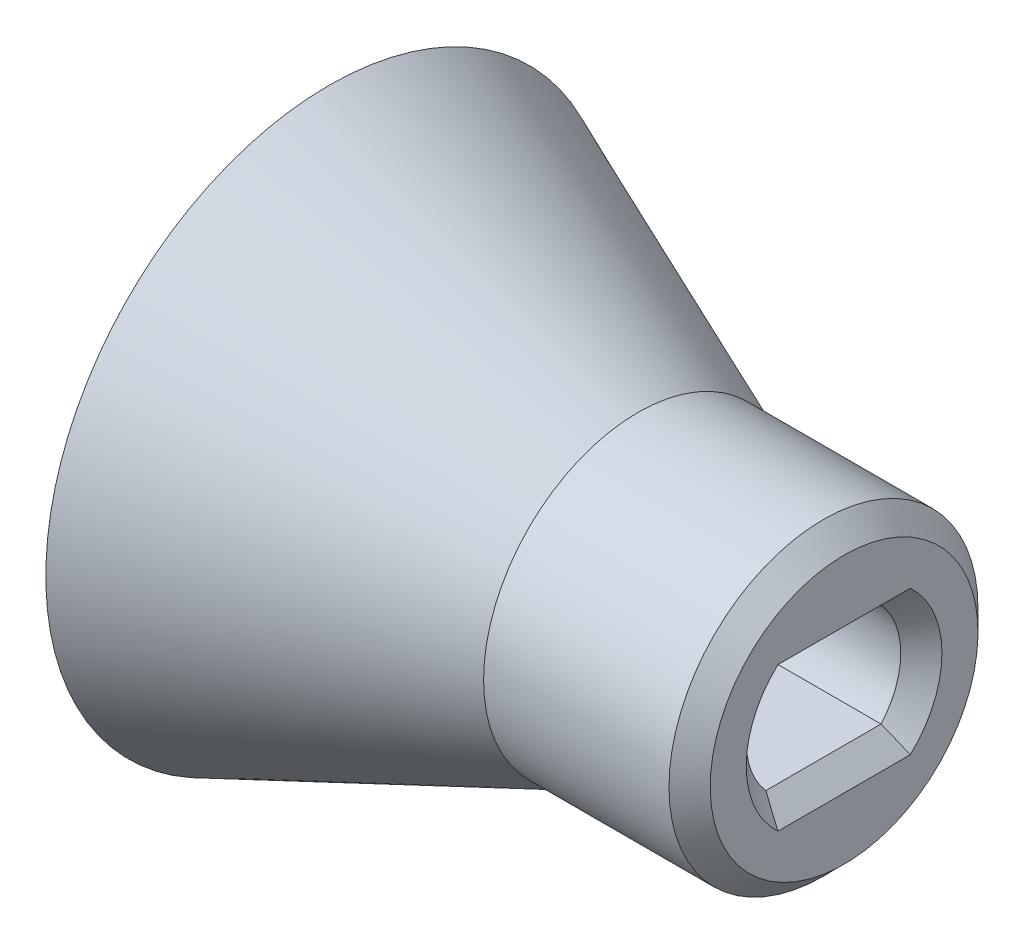
from build123d import *

# Parameters (mm, degrees)
CUT_EXTRUDE1_DEPTH = 8
CHAMFER1_SIZE      = 0.8


with BuildPart() as part:
    # Sketch2 → Revolve1 (revolve)
    with BuildSketch(Plane.XY):
        Polygon((0, 0), (0, 11), (12, 6), (20, 6), (20, 0), align=None)
    revolve(axis=Axis((20, 0, 0), (-1, 0, 0)))

    # Sketch3 → Cut-Extrude1 (cut)
    with BuildSketch(Plane(origin=(20, 0, 0), x_dir=(0, 0, -1), z_dir=(1, 0, 0))):
        with BuildLine():
            Line((-2.236067977, 2), (2.236067977, 2))
            ThreePointArc((2.236067977, 2), (3, 0), (2.236067977, -2))
            Line((2.236067977, -2), (-2.236067977, -2))
            ThreePointArc((-2.236067977, -2), (-3, 0), (-2.236067977, 2))
        make_face()
    extrude(amount=-CUT_EXTRUDE1_DEPTH, mode=Mode.SUBTRACT)

    # Chamfer1
    chamfer1_edges = [part.edges().sort_by_distance(p)[0] for p in [
        (20, 0, 3),
        (20, -2, 0),
        (20, 0, -3),
        (20, 2, 0),
        (20, -6, 0),
    ]]
    chamfer(chamfer1_edges, length=CHAMFER1_SIZE)


solid = part.part
